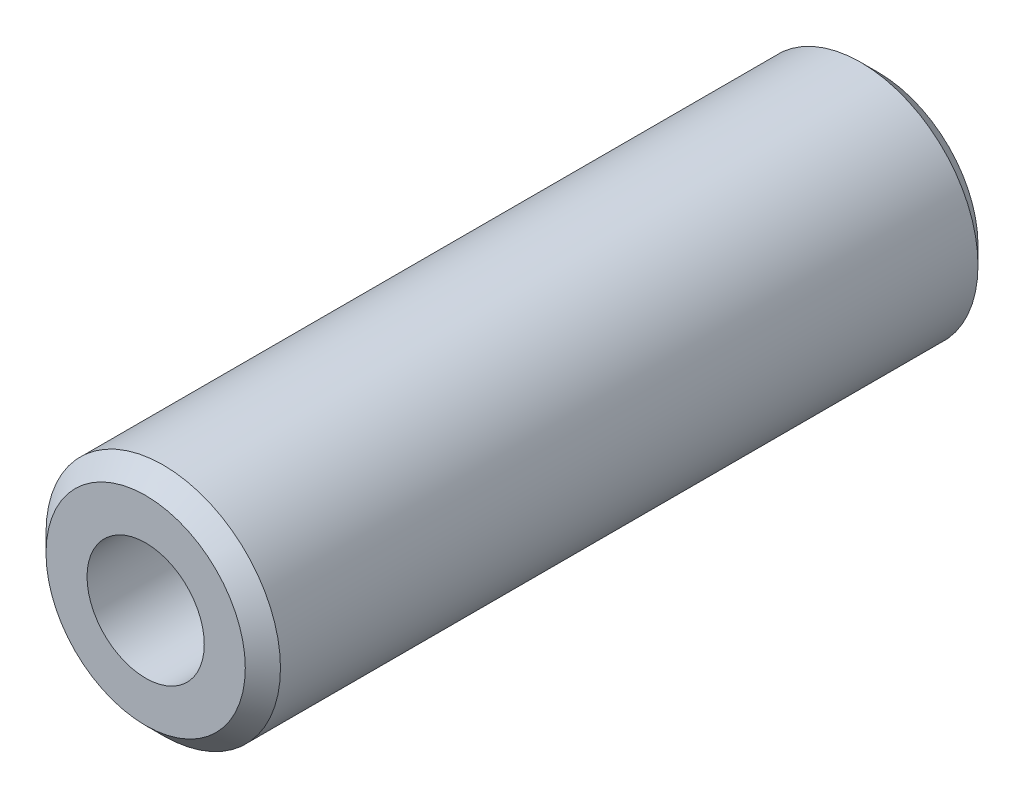
from build123d import *

# Parameters (mm, degrees)
BOSS_EXTRUDE1_DEPTH      = 12.5
BOSS_EXTRUDE1_DEPTH_BACK = 12.5
SKETCH3_R                = 4
CHAMFER1_SIZE            = 0.6
SKETCH4_R                = 2
CUT_EXTRUDE1_DEPTH       = 42


with BuildPart() as part:
    # Sketch3 → Boss-Extrude1 (new, two sides: drawn at the far end of the back side and taken through both)
    with BuildSketch(Plane.XY.offset(-BOSS_EXTRUDE1_DEPTH_BACK)):
        Circle(SKETCH3_R)
    extrude(amount=BOSS_EXTRUDE1_DEPTH + BOSS_EXTRUDE1_DEPTH_BACK)

    # Chamfer1
    chamfer1_edges = [part.edges().sort_by_distance(p)[0] for p in [
        (-4, 0, -12.5),
        (-4, 0, 12.5),
    ]]
    chamfer(chamfer1_edges, length=CHAMFER1_SIZE)

    # Sketch4 → Cut-Extrude1 (cut)
    with BuildSketch(Plane(origin=(0, 0, -12.5), x_dir=(-1, 0, 0), z_dir=(0, 0, -1))):
        Circle(SKETCH4_R)
    extrude(amount=-CUT_EXTRUDE1_DEPTH, mode=Mode.SUBTRACT)


solid = part.part
